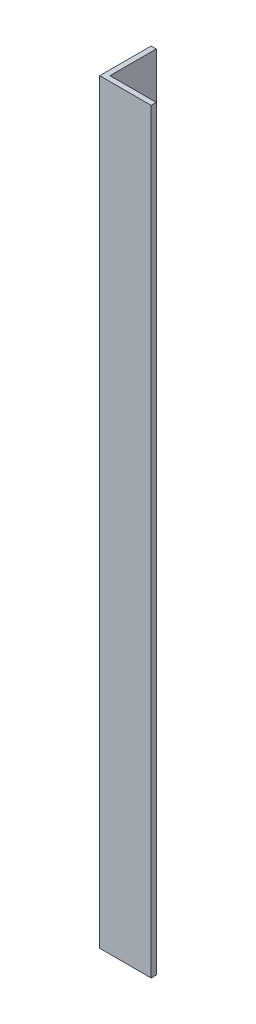
from build123d import *

# Parameters (mm, degrees)
BOSS_EXTRUDE1_DEPTH = 294


with BuildPart() as part:
    # Sketch1 → Boss-Extrude1 (new body)
    with BuildSketch(Plane(origin=(0, 0, 0), x_dir=(1, 0, 0), z_dir=(0, 1, 0))):
        Polygon((0, 0), (20, 0), (20, 2), (2, 2), (2, 20), (0, 20), align=None)
    extrude(amount=BOSS_EXTRUDE1_DEPTH)


solid = part.part
